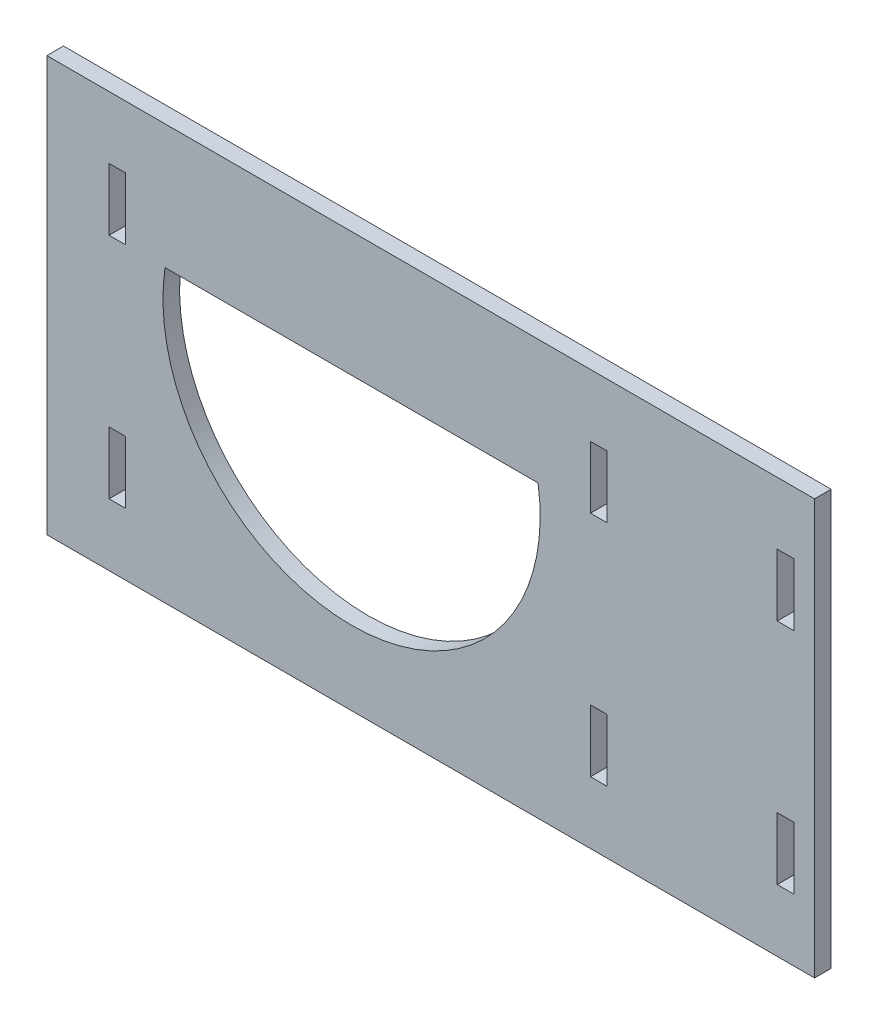
from build123d import *

# Parameters (mm, degrees)
SKETCH1_W           = 4
SKETCH1_H           = 15
BOSS_EXTRUDE1_DEPTH = 4


with BuildPart() as part:
    # Sketch1 → Boss-Extrude1 (new body)
    with BuildSketch(Plane.XY):
        Polygon((-75, -50), (75, -50), (110, -50), (110, 50), (75, 50), (-75, 50), align=None)
        with BuildLine():
            Line((-46.516283173, 20), (43.374974686, 20))
            ThreePointArc((43.374974686, 20), (-1.570654243, -32.179711562), (-46.516283173, 20))
        make_face(mode=Mode.SUBTRACT)
        with Locations((58, 27.5)):
            Rectangle(SKETCH1_W, SKETCH1_H, mode=Mode.SUBTRACT)
        with Locations((58, -27.5)):
            Rectangle(SKETCH1_W, SKETCH1_H, mode=Mode.SUBTRACT)
        with Locations((-58, -27.5)):
            Rectangle(SKETCH1_W, SKETCH1_H, mode=Mode.SUBTRACT)
        with Locations((-58, 27.5)):
            Rectangle(SKETCH1_W, SKETCH1_H, mode=Mode.SUBTRACT)
        with Locations((103, 27.5)):
            Rectangle(SKETCH1_W, SKETCH1_H, mode=Mode.SUBTRACT)
        with Locations((103, -27.5)):
            Rectangle(SKETCH1_W, SKETCH1_H, mode=Mode.SUBTRACT)
    extrude(amount=BOSS_EXTRUDE1_DEPTH)


solid = part.part
